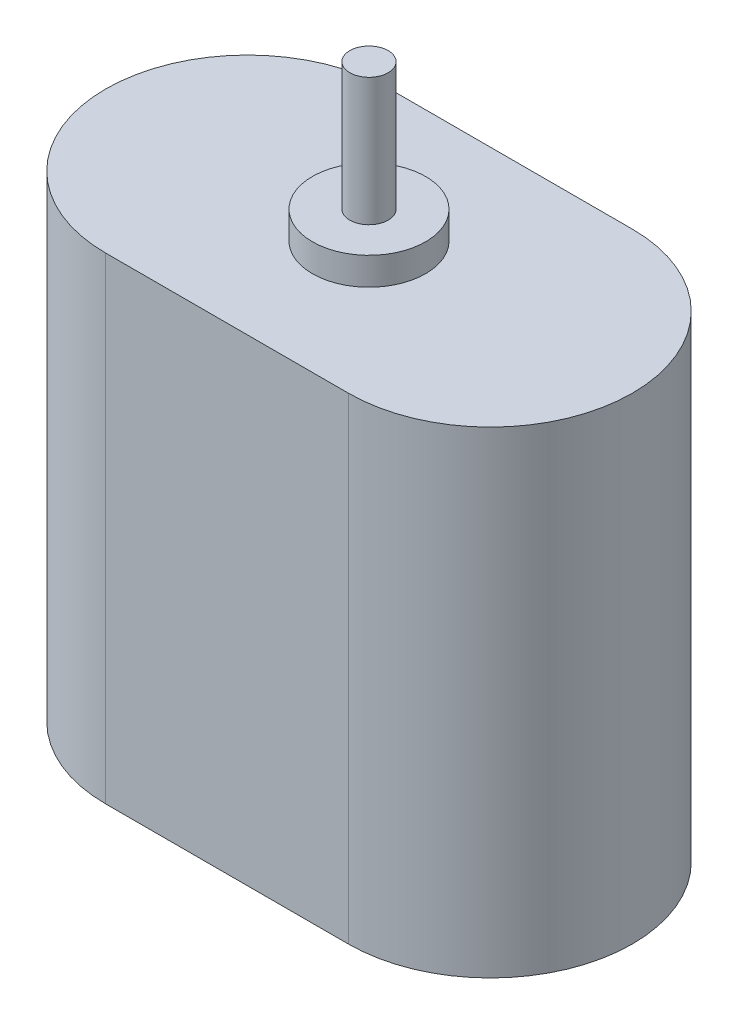
from build123d import *

# Parameters (mm, degrees)
BOSS_EXTRUDE1_DEPTH = 24.9555
SKETCH2_R           = 2.96037
SKETCH2_R_2         = 1.0033
BOSS_EXTRUDE2_DEPTH = 1.4478
SKETCH2_3_R         = 1.0033
BOSS_EXTRUDE3_DEPTH = 8.128
BOSS_EXTRUDE4_DEPTH = 1.905


with BuildPart() as part:
    # Sketch1 → Boss-Extrude1 (new body)
    with BuildSketch(Plane(origin=(0, 0, 0), x_dir=(1, 0, 0), z_dir=(0, 1, 0))):
        with BuildLine():
            Line((6.35, 7.4295), (-6.35, 7.4295))
            ThreePointArc((-6.35, 7.4295), (-13.7795, 0), (-6.35, -7.4295))
            Line((-6.35, -7.4295), (6.35, -7.4295))
            ThreePointArc((6.35, -7.4295), (13.7795, 0), (6.35, 7.4295))
        make_face()
    extrude(amount=BOSS_EXTRUDE1_DEPTH)

    # Sketch2 → Boss-Extrude2 (add)
    with BuildSketch(Plane(origin=(0, 24.9555, 0), x_dir=(1, 0, 0), z_dir=(0, 1, 0))):
        Circle(SKETCH2_R)
        Circle(SKETCH2_R_2, mode=Mode.SUBTRACT)
    extrude(amount=BOSS_EXTRUDE2_DEPTH)

    # Sketch2<3> → Boss-Extrude3 (add)
    with BuildSketch(Plane(origin=(0, 24.9555, 0), x_dir=(1, 0, 0), z_dir=(0, 1, 0))):
        Circle(SKETCH2_3_R)
    extrude(amount=BOSS_EXTRUDE3_DEPTH)

    # Sketch3 → Boss-Extrude4 (add)
    with BuildSketch(Plane.XZ):
        with BuildLine():
            Line((-2.815278068, -4.0132), (2.815278068, -4.0132))
            ThreePointArc((2.815278068, -4.0132), (0, 4.9022), (-2.815278068, -4.0132))
        make_face()
    extrude(amount=BOSS_EXTRUDE4_DEPTH)


solid = part.part
